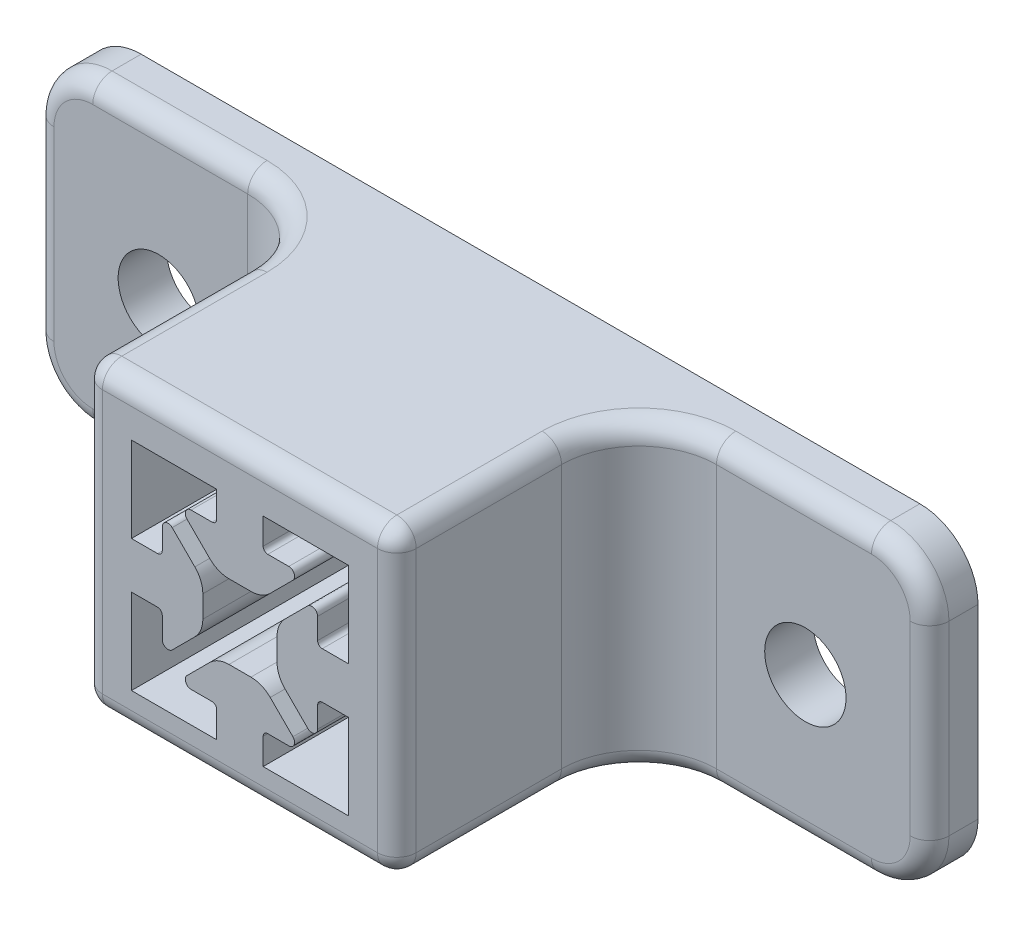
from build123d import *

# Parameters (mm, degrees)
SKETCH2_W           = 32.4
SKETCH2_H           = 31.2
BOSS_EXTRUDE1_DEPTH = 30
SKETCH3_W           = 5
SKETCH3_H           = 31.2
BOSS_EXTRUDE2_DEPTH = 30
SKETCH4_R           = 4.198469776
CUT_EXTRUDE1_DEPTH  = 15
FILLET6_R           = 8
FILLET7_R           = 6
FILLET8_R           = 2


with BuildPart() as part:
    # Sketch2 → Boss-Extrude1 (new body)
    with BuildSketch(Plane.XY.offset(-585.734831934)):
        with Locations((-220.618842126, 630.6)):
            Rectangle(SKETCH2_W, SKETCH2_H)
        with BuildLine():
            Line((-218.223842126, 639.2), (-218.223842126, 638.500000763))
            ThreePointArc((-218.223842126, 638.500000763), (-218.083253443, 638.160589569), (-217.743842299, 638.020000763))
            Line((-217.743842299, 638.020000763), (-215.574720714, 638.019999981))
            ThreePointArc((-215.574720714, 638.019999981), (-215.020393169, 637.649609941), (-215.150456861, 636.995735913))
            Line((-215.150456861, 636.995735913), (-217.490233892, 634.655958882))
            ThreePointArc((-217.490233892, 634.655958882), (-218.405107733, 634.044659724), (-219.484275009, 633.830000005))
            Line((-219.484275009, 633.830000005), (-221.753409227, 633.83))
            ThreePointArc((-221.753409227, 633.83), (-222.83257651, 634.044659717), (-223.747450356, 634.655958877))
            Line((-223.747450356, 634.655958877), (-226.087227386, 636.995735907))
            ThreePointArc((-226.087227386, 636.995735907), (-226.217291078, 637.649609934), (-225.662963535, 638.019999975))
            Line((-225.662963535, 638.019999975), (-223.493841952, 638.020000763))
            ThreePointArc((-223.493841952, 638.020000763), (-223.15443081, 638.16058957), (-223.013842126, 638.500000763))
            Line((-223.013842126, 638.500000763), (-223.013842126, 639.2))
            Line((-223.013842126, 639.2), (-223.013842126, 641.2))
            Line((-223.013842126, 641.2), (-231.818842126, 641.2))
            Line((-231.818842126, 641.2), (-231.818842126, 632.395))
            Line((-231.818842126, 632.395), (-229.818842126, 632.395))
            Line((-229.818842126, 632.395), (-229.118842889, 632.395))
            ThreePointArc((-229.118842889, 632.395), (-228.779431696, 632.535588684), (-228.638842889, 632.874999827))
            Line((-228.638842889, 632.874999827), (-228.638842108, 635.044121413))
            ThreePointArc((-228.638842108, 635.044121413), (-228.268452067, 635.598448957), (-227.614578039, 635.468385265))
            Line((-227.614578039, 635.468385265), (-225.274801008, 633.128608235))
            ThreePointArc((-225.274801008, 633.128608235), (-224.663501851, 632.213734394), (-224.448842131, 631.134567117))
            Line((-224.448842131, 631.134567117), (-224.448842127, 628.865432899))
            ThreePointArc((-224.448842127, 628.865432899), (-224.663501844, 627.786265617), (-225.274801004, 626.87139177))
            Line((-225.274801004, 626.87139177), (-227.614578033, 624.531614741))
            ThreePointArc((-227.614578033, 624.531614741), (-228.268452061, 624.401551048), (-228.638842102, 624.955878592))
            Line((-228.638842102, 624.955878592), (-228.638842889, 627.125000174))
            ThreePointArc((-228.638842889, 627.125000174), (-228.779431696, 627.464411317), (-229.118842889, 627.605))
            Line((-229.118842889, 627.605), (-229.818842126, 627.605))
            Line((-229.818842126, 627.605), (-231.818842126, 627.605))
            Line((-231.818842126, 627.605), (-231.818842126, 618.8))
            Line((-231.818842126, 618.8), (-223.013842126, 618.8))
            Line((-223.013842126, 618.8), (-223.013842126, 620.8))
            Line((-223.013842126, 620.8), (-223.013842126, 621.499999237))
            ThreePointArc((-223.013842126, 621.499999237), (-223.15443081, 621.839410431), (-223.493841954, 621.979999237))
            Line((-223.493841954, 621.979999237), (-225.662963539, 621.980000019))
            ThreePointArc((-225.662963539, 621.980000019), (-226.217291084, 622.350390059), (-226.087227392, 623.004264087))
            Line((-226.087227392, 623.004264087), (-223.747450361, 625.344041118))
            ThreePointArc((-223.747450361, 625.344041118), (-222.83257652, 625.955340276), (-221.753409244, 626.169999995))
            Line((-221.753409244, 626.169999995), (-219.484275025, 626.17))
            ThreePointArc((-219.484275025, 626.17), (-218.405107743, 625.955340283), (-217.490233897, 625.344041123))
            Line((-217.490233897, 625.344041123), (-215.150456867, 623.004264093))
            ThreePointArc((-215.150456867, 623.004264093), (-215.020393175, 622.350390066), (-215.574720718, 621.980000025))
            Line((-215.574720718, 621.980000025), (-217.743842301, 621.979999237))
            ThreePointArc((-217.743842301, 621.979999237), (-218.083253443, 621.83941043), (-218.223842126, 621.499999237))
            Line((-218.223842126, 621.499999237), (-218.223842126, 620.8))
            Line((-218.223842126, 620.8), (-218.223842126, 618.8))
            Line((-218.223842126, 618.8), (-209.418842126, 618.8))
            Line((-209.418842126, 618.8), (-209.418842126, 627.605))
            Line((-209.418842126, 627.605), (-211.418842126, 627.605))
            Line((-211.418842126, 627.605), (-212.118841364, 627.605))
            ThreePointArc((-212.118841364, 627.605), (-212.458252557, 627.464411316), (-212.598841364, 627.125000173))
            Line((-212.598841364, 627.125000173), (-212.598842145, 624.955878587))
            ThreePointArc((-212.598842145, 624.955878587), (-212.969232185, 624.401551043), (-213.623106214, 624.531614735))
            Line((-213.623106214, 624.531614735), (-215.962883245, 626.871391765))
            ThreePointArc((-215.962883245, 626.871391765), (-216.574182402, 627.786265606), (-216.788842122, 628.865432883))
            Line((-216.788842122, 628.865432883), (-216.788842126, 631.134567101))
            ThreePointArc((-216.788842126, 631.134567101), (-216.574182409, 632.213734383), (-215.962883249, 633.12860823))
            Line((-215.962883249, 633.12860823), (-213.62310622, 635.468385259))
            ThreePointArc((-213.62310622, 635.468385259), (-212.969232192, 635.598448952), (-212.598842151, 635.044121408))
            Line((-212.598842151, 635.044121408), (-212.598841364, 632.874999826))
            ThreePointArc((-212.598841364, 632.874999826), (-212.458252557, 632.535588683), (-212.118841364, 632.395))
            Line((-212.118841364, 632.395), (-211.418842126, 632.395))
            Line((-211.418842126, 632.395), (-209.418842126, 632.395))
            Line((-209.418842126, 632.395), (-209.418842126, 641.2))
            Line((-209.418842126, 641.2), (-218.223842126, 641.2))
            Line((-218.223842126, 641.2), (-218.223842126, 639.2))
        make_face(mode=Mode.SUBTRACT)
    extrude(amount=BOSS_EXTRUDE1_DEPTH)

    # Sketch3 → Boss-Extrude2 (add)
    with BuildSketch(Plane(origin=(-204.418842126, 0, 0), x_dir=(0, 0, -1), z_dir=(1, 0, 0))):
        with Locations((583.234831934, 630.6)):
            Rectangle(SKETCH3_W, SKETCH3_H)
    boss_extrude2 = extrude(amount=BOSS_EXTRUDE2_DEPTH)

    # Sketch4 → Cut-Extrude1 (cut, symmetric)
    with BuildSketch(Plane.XY.offset(-580.734831934)):
        with Locations((-187.243842126, 630)):
            Circle(SKETCH4_R)
    cut_extrude1 = extrude(amount=CUT_EXTRUDE1_DEPTH, both=True, mode=Mode.SUBTRACT)

    # Mirror6: Boss-Extrude2 across plane
    add(boss_extrude2.mirror(Plane(origin=(-220.618842126, 0, 0), x_dir=(0, 0, 1), z_dir=(1, 0, 0))))

    # Mirror9: Cut-Extrude1 across plane
    add(cut_extrude1.mirror(Plane(origin=(-220.618842126, 0, 0), x_dir=(0, 0, 1), z_dir=(1, 0, 0))), mode=Mode.SUBTRACT)

    # Fillet6
    fillet6_edges = [part.edges().sort_by_distance(p)[0] for p in [
        (-204.418842126, 630.6, -580.734831934),
        (-236.818842126, 630.6, -580.734831934),
    ]]
    fillet(fillet6_edges, radius=FILLET6_R)

    # Fillet7
    fillet7_edges = [part.edges().sort_by_distance(p)[0] for p in [
        (-174.418842126, 646.2, -583.234831934),
        (-174.418842126, 615, -583.234831934),
        (-266.818842126, 615, -583.234831934),
        (-266.818842126, 646.2, -583.234831934),
    ]]
    fillet(fillet7_edges, radius=FILLET7_R)

    # Fillet8
    fillet8_edges = [part.edges().sort_by_distance(p)[0] for p in [
        (-204.418842126, 630.6, -555.734831934),
        (-220.618842126, 646.2, -555.734831934),
        (-239.161987877, 615, -578.391686183),
        (-239.161987877, 646.2, -578.391686183),
        (-202.075696376, 615, -578.391686183),
        (-202.075696376, 646.2, -578.391686183),
        (-188.418842126, 615, -580.734831934),
        (-252.818842126, 615, -580.734831934),
        (-266.818842126, 630.6, -580.734831934),
        (-252.818842126, 646.2, -580.734831934),
        (-265.061482814, 644.442640687, -580.734831934),
        (-265.061482814, 616.757359313, -580.734831934),
        (-188.418842126, 646.2, -580.734831934),
        (-174.418842126, 630.6, -580.734831934),
        (-176.176201439, 644.442640687, -580.734831934),
        (-176.176201439, 616.757359313, -580.734831934),
        (-236.818842126, 630.6, -555.734831934),
        (-236.818842126, 646.2, -564.234831934),
        (-204.418842126, 646.2, -564.234831934),
        (-204.418842126, 615, -564.234831934),
        (-236.818842126, 615, -564.234831934),
        (-220.618842126, 615, -555.734831934),
    ]]
    fillet(fillet8_edges, radius=FILLET8_R)


solid = part.part
